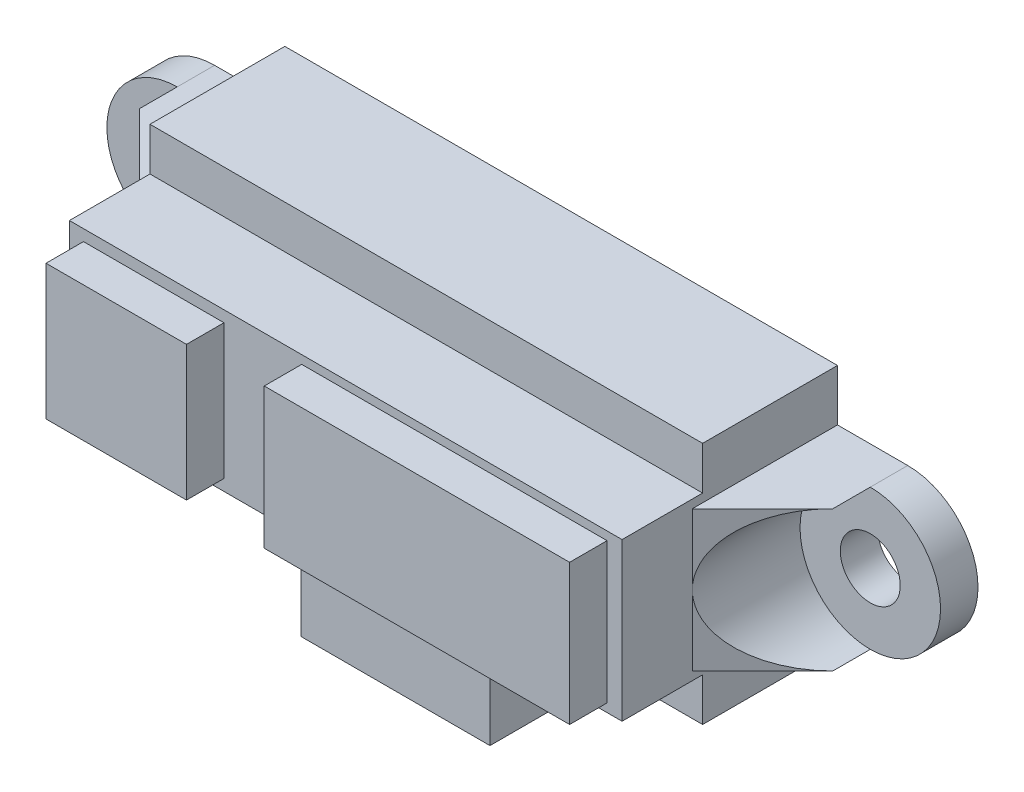
from build123d import *

# Parameters (mm, degrees)
SKETCH1_W               = 29.5
SKETCH1_H               = 8.4
BOSS_EXTRUDE1_DEPTH     = 11.5
SKETCH2_W               = 7.5
SKETCH2_H               = 7.2
SKETCH2_W_2             = 16.3
SKETCH2_H_2             = 7.5
BOSS_EXTRUDE2_DEPTH     = 2
SKETCH3_W               = 29.5
SKETCH3_H               = 13
BOSS_EXTRUDE3_DEPTH     = 7.2
BOSS_EXTRUDE4_DEPTH     = 5.05
SKETCH5_R               = 1.6
BOSS_EXTRUDE5_DEPTH     = 10
CUT_EXTRUDE1_START      = -8
SKETCH8_R               = 3.75
CUT_EXTRUDE1_DEPTH      = 8
CUT_EXTRUDE2_DEPTH      = 29.452811812
CUT_EXTRUDE2_DEPTH_BACK = 29.452811812


with BuildPart() as part:
    # Sketch1 → Boss-Extrude1 (new body)
    with BuildSketch(Plane.XY):
        Rectangle(SKETCH1_W, SKETCH1_H)
    extrude(amount=BOSS_EXTRUDE1_DEPTH)

    # Sketch2 → Boss-Extrude2 (add)
    with BuildSketch(Plane.XY.offset(11.5)):
        with Locations((-10.25, 0)):
            Rectangle(SKETCH2_W, SKETCH2_H)
        with Locations((5.8, 0)):
            Rectangle(SKETCH2_W_2, SKETCH2_H_2)
    extrude(amount=BOSS_EXTRUDE2_DEPTH)

    # Sketch3 → Boss-Extrude3 (add)
    with BuildSketch(Plane.XY):
        Rectangle(SKETCH3_W, SKETCH3_H)
    extrude(amount=BOSS_EXTRUDE3_DEPTH)

    # Sketch4 → Boss-Extrude4 (add, symmetric)
    with BuildSketch(Plane(origin=(0, 0, 0), x_dir=(0, 0, -1), z_dir=(1, 0, 0))):
        Polygon((-5.55, -6.5), (-5.55, -11.5), (-8.85, -11.5), (-8.85, -6.5), (-8.35, -6.5), (-7.2, -5.35), (-7.2, -6.5), align=None)
    extrude(amount=BOSS_EXTRUDE4_DEPTH, both=True)

    # Sketch5 → Boss-Extrude5 (add)
    # profile 1 of 2: a face of its own
    with BuildSketch(Plane.XY):
        with BuildLine():
            Line((-18.5, 3.75), (-14.75, 3.75))
            Line((-14.75, 3.75), (-14.75, -3.75))
            Line((-14.75, -3.75), (-18.5, -3.75))
            ThreePointArc((-18.5, -3.75), (-22.25, 0), (-18.5, 3.75))
        make_face()
        with Locations((-18.5, 0)):
            Circle(SKETCH5_R, mode=Mode.SUBTRACT)
    # profile 2 of 2: a face of its own
    with BuildSketch(Plane.XY):
        with BuildLine():
            Line((18.5, 3.75), (14.75, 3.75))
            Line((14.75, 3.75), (14.75, -3.75))
            Line((14.75, -3.75), (18.5, -3.75))
            ThreePointArc((18.5, -3.75), (22.25, 0), (18.5, 3.75))
        make_face()
        with Locations((18.5, 0)):
            Circle(SKETCH5_R, mode=Mode.SUBTRACT)
    extrude(amount=BOSS_EXTRUDE5_DEPTH)

    # Sketch8 → Cut-Extrude1 (cut)
    with BuildSketch(Plane.XY.offset(10).offset(CUT_EXTRUDE1_START)):
        with Locations((-18.5, 0)):
            Circle(SKETCH8_R)
        with Locations((18.5, 0)):
            Circle(SKETCH8_R)
    extrude(amount=CUT_EXTRUDE1_DEPTH, mode=Mode.SUBTRACT)

    # Sketch9 → Cut-Extrude2 (cut, two sides: drawn at the far end of the back side and taken through both)
    with BuildSketch(Plane(origin=(0, 0, 0), x_dir=(1, 0, 0), z_dir=(0, 1, 0)).offset(-CUT_EXTRUDE2_DEPTH_BACK)):
        Polygon((-18.5, -4), (-14.75, -7.75), (-14.75, -10), (-18.5, -10), align=None)
        Polygon((18.5, -10), (18.5, -4), (14.75, -7.75), (14.75, -10), align=None)
    extrude(amount=CUT_EXTRUDE2_DEPTH + CUT_EXTRUDE2_DEPTH_BACK, mode=Mode.SUBTRACT)


solid = part.part
